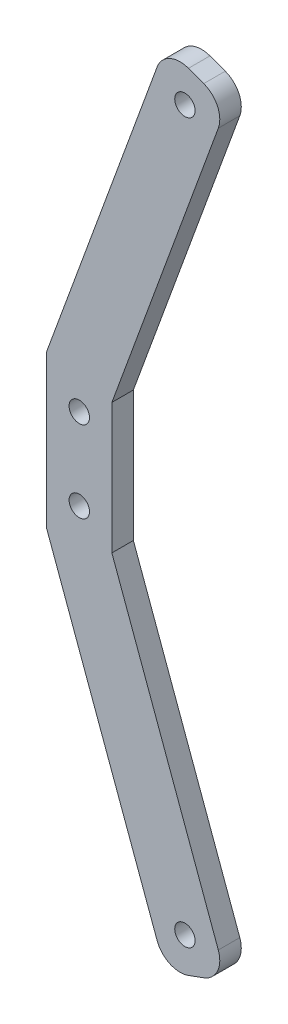
from build123d import *

# Parameters (mm, degrees)
EXTRUDE1_DEPTH       = 8.382
SKETCH2_R            = 3.96875
CUT_EXTRUDE1_DEPTH   = 172.593904288
FILLET4_R            = 9.525
FILLET4_OF_MIRROR1_R = 9.525


with BuildPart() as part:
    # Sketch1 → Extrude1 (new body)
    with BuildSketch(Plane.XY):
        Polygon((0, 0), (0, 29.903849897), (46.305765967, 156.371903759), (70.157236117, 147.638784517), (25.4, 25.4), (25.4, 0), align=None)
    extrude1 = extrude(amount=EXTRUDE1_DEPTH)

    # Sketch2 → Cut-Extrude1 (cut, through all)
    with BuildSketch(Plane(origin=(0, 0, 0), x_dir=(-1, 0, 0), z_dir=(0, 0, -1))):
        with Locations((-53.864941421, 140.079609063)):
            Circle(SKETCH2_R)
        with Locations((-12.7, 15.875)):
            Circle(SKETCH2_R)
    cut_extrude1 = extrude(amount=-CUT_EXTRUDE1_DEPTH, mode=Mode.SUBTRACT)

    # Fillet4
    fillet4_edges = [part.edges().sort_by_distance(p)[0] for p in [
        (46.305765967, 156.371903759, 4.191),
        (70.157236117, 147.638784517, 4.191),
    ]]
    fillet(fillet4_edges, radius=FILLET4_R)

    # Mirror1: Extrude1, Cut-Extrude1 across plane
    add(extrude1.mirror(Plane(origin=(25.4, 0, 8.382), x_dir=(0, 0, 1), z_dir=(0, 1, 0))))
    add(cut_extrude1.mirror(Plane(origin=(25.4, 0, 8.382), x_dir=(0, 0, 1), z_dir=(0, 1, 0))), mode=Mode.SUBTRACT)

    # Fillet4 of Mirror1
    fillet4_of_mirror1_edges = [part.edges().sort_by_distance(p)[0] for p in [
        (46.305765967, -156.371903759, 4.191),
        (70.157236117, -147.638784517, 4.191),
    ]]
    fillet(fillet4_of_mirror1_edges, radius=FILLET4_OF_MIRROR1_R)


solid = part.part
